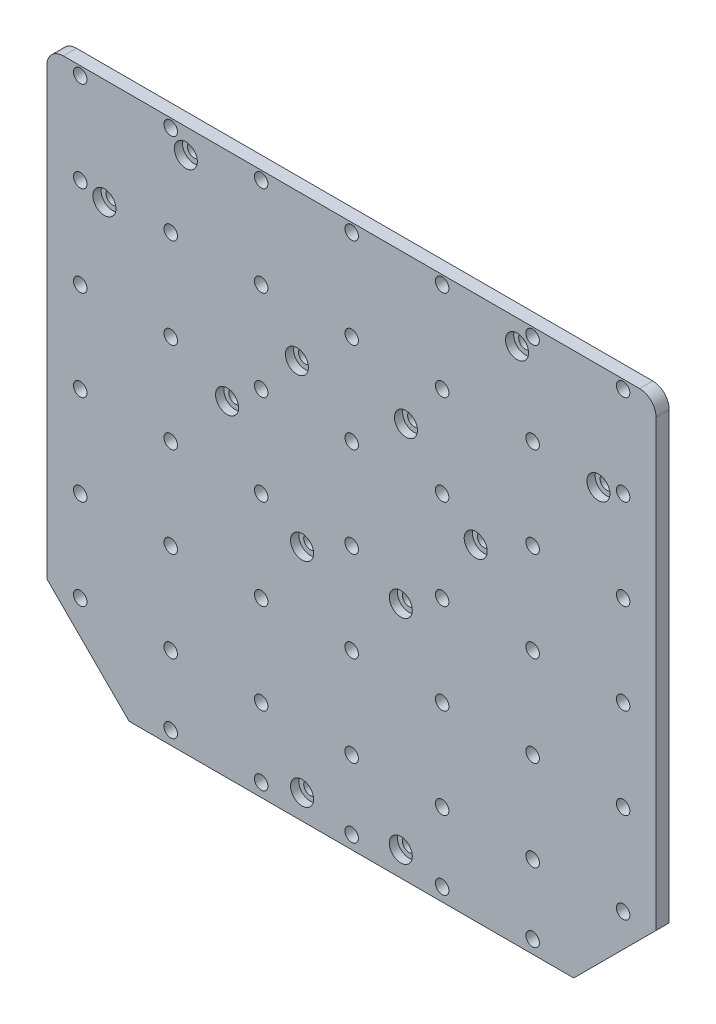
from build123d import *

# Parameters (mm, degrees)
ESQUISSE2_W             = 370.3
ESQUISSE2_H             = 330.3
BOSS_EXTRU_1_DEPTH      = 8
CONG_1_R                = 10
CHANFREIN1_SIZE         = 50
ESQUISSE4_R             = 4
ENL_V_MAT_EXTRU_1_DEPTH = 10
ESQUISSE5_R             = 7
ENL_V_MAT_EXTRU_2_DEPTH = 5
ESQUISSE6_R             = 4.1
ENL_V_MAT_EXTRU_3_DEPTH = 10


with BuildPart() as part:
    # Esquisse2 → Boss.-Extru.1 (new body)
    with BuildSketch(Plane.XY):
        with Locations((0, 191)):
            Rectangle(ESQUISSE2_W, ESQUISSE2_H)
    extrude(amount=BOSS_EXTRU_1_DEPTH)

    # Congé1
    cong_1_edges = [part.edges().sort_by_distance(p)[0] for p in [
        (-185.15, 356.15, 4),
        (185.15, 356.15, 4),
    ]]
    fillet(cong_1_edges, radius=CONG_1_R)

    # Chanfrein1
    chanfrein1_edges = [part.edges().sort_by_distance(p)[0] for p in [
        (185.15, 25.85, 4),
        (-185.15, 25.85, 4),
    ]]
    chamfer(chanfrein1_edges, length=CHANFREIN1_SIZE)

    # Esquisse4 → Enlèv. mat.-Extru.1 (cut)
    with BuildSketch(Plane.XY.offset(8)):
        with Locations((30, 170.289321881)):
            Circle(ESQUISSE4_R)
        with Locations(Location((-30, 170.289321881, 0), (0, 0, 180))):
            Circle(ESQUISSE4_R)
        with Locations((-33.142135624, 266.568542495)):
            Circle(ESQUISSE4_R)
        with Locations(Location((-75.568542495, 224.142135624, 0), (0, 0, 180))):
            Circle(ESQUISSE4_R)
        with Locations((33.142135624, 266.568542495)):
            Circle(ESQUISSE4_R)
        with Locations(Location((75.568542495, 224.142135624, 0), (0, 0, 180))):
            Circle(ESQUISSE4_R)
        with Locations((30, 40.85)):
            Circle(ESQUISSE4_R)
        with Locations(Location((-30, 40.85, 0), (0, 0, 180))):
            Circle(ESQUISSE4_R)
        with Locations((-100.652525317, 341.15)):
            Circle(ESQUISSE4_R)
        with Locations(Location((-150.15, 291.652525317, 0), (0, 0, 180))):
            Circle(ESQUISSE4_R)
        with Locations(Location((100.652525317, 341.15, 0), (0, 0, 180))):
            Circle(ESQUISSE4_R)
        with Locations((150.15, 291.652525317)):
            Circle(ESQUISSE4_R)
    extrude(amount=-ENL_V_MAT_EXTRU_1_DEPTH, mode=Mode.SUBTRACT)

    # Esquisse5 → Enlèv. mat.-Extru.2 (cut)
    with BuildSketch(Plane.XY.offset(8)):
        with Locations((30, 40.85)):
            Circle(ESQUISSE5_R)
        with Locations((-30, 40.85)):
            Circle(ESQUISSE5_R)
        with Locations((30, 170.289321881)):
            Circle(ESQUISSE5_R)
        with Locations((-30, 170.289321881)):
            Circle(ESQUISSE5_R)
        with Locations((75.568542495, 224.142135624)):
            Circle(ESQUISSE5_R)
        with Locations((33.142135624, 266.568542495)):
            Circle(ESQUISSE5_R)
        with Locations((150.15, 291.652525317)):
            Circle(ESQUISSE5_R)
        with Locations((100.652525317, 341.15)):
            Circle(ESQUISSE5_R)
        with Locations((-33.142135624, 266.568542495)):
            Circle(ESQUISSE5_R)
        with Locations((-75.568542495, 224.142135624)):
            Circle(ESQUISSE5_R)
        with Locations((-150.15, 291.652525317)):
            Circle(ESQUISSE5_R)
        with Locations((-100.652525317, 341.15)):
            Circle(ESQUISSE5_R)
    extrude(amount=-ENL_V_MAT_EXTRU_2_DEPTH, mode=Mode.SUBTRACT)

    # Esquisse6 → Enlèv. mat.-Extru.3 (cut)
    with BuildSketch(Plane.XY.offset(8)):
        with Locations((165.15, 75.85)):
            Circle(ESQUISSE6_R)
        with Locations((110.15, 75.85)):
            Circle(ESQUISSE6_R)
        with Locations((55.15, 75.85)):
            Circle(ESQUISSE6_R)
        with Locations((0.15, 75.85)):
            Circle(ESQUISSE6_R)
        with Locations((-54.85, 75.85)):
            Circle(ESQUISSE6_R)
        with Locations((-109.85, 75.85)):
            Circle(ESQUISSE6_R)
        with Locations((-164.85, 75.85)):
            Circle(ESQUISSE6_R)
        with Locations((110.15, 130.85)):
            Circle(ESQUISSE6_R)
        with Locations((55.15, 130.85)):
            Circle(ESQUISSE6_R)
        with Locations((0.15, 130.85)):
            Circle(ESQUISSE6_R)
        with Locations((-54.85, 130.85)):
            Circle(ESQUISSE6_R)
        with Locations((-109.85, 130.85)):
            Circle(ESQUISSE6_R)
        with Locations((-164.85, 130.85)):
            Circle(ESQUISSE6_R)
        with Locations((110.15, 185.85)):
            Circle(ESQUISSE6_R)
        with Locations((55.15, 185.85)):
            Circle(ESQUISSE6_R)
        with Locations((0.15, 185.85)):
            Circle(ESQUISSE6_R)
        with Locations((-54.85, 185.85)):
            Circle(ESQUISSE6_R)
        with Locations((-109.85, 185.85)):
            Circle(ESQUISSE6_R)
        with Locations((-164.85, 185.85)):
            Circle(ESQUISSE6_R)
        with Locations((110.15, 240.85)):
            Circle(ESQUISSE6_R)
        with Locations((55.15, 240.85)):
            Circle(ESQUISSE6_R)
        with Locations((0.15, 240.85)):
            Circle(ESQUISSE6_R)
        with Locations((-54.85, 240.85)):
            Circle(ESQUISSE6_R)
        with Locations((-109.85, 240.85)):
            Circle(ESQUISSE6_R)
        with Locations((-164.85, 240.85)):
            Circle(ESQUISSE6_R)
        with Locations((110.15, 295.85)):
            Circle(ESQUISSE6_R)
        with Locations((55.15, 295.85)):
            Circle(ESQUISSE6_R)
        with Locations((0.15, 295.85)):
            Circle(ESQUISSE6_R)
        with Locations((-54.85, 295.85)):
            Circle(ESQUISSE6_R)
        with Locations((-109.85, 295.85)):
            Circle(ESQUISSE6_R)
        with Locations((-164.85, 295.85)):
            Circle(ESQUISSE6_R)
        with Locations((110.15, 350.85)):
            Circle(ESQUISSE6_R)
        with Locations((55.15, 350.85)):
            Circle(ESQUISSE6_R)
        with Locations((0.15, 350.85)):
            Circle(ESQUISSE6_R)
        with Locations((-54.85, 350.85)):
            Circle(ESQUISSE6_R)
        with Locations((-109.85, 350.85)):
            Circle(ESQUISSE6_R)
        with Locations((-164.85, 350.85)):
            Circle(ESQUISSE6_R)
        with Locations((165.15, 130.85)):
            Circle(ESQUISSE6_R)
        with Locations((165.15, 185.85)):
            Circle(ESQUISSE6_R)
        with Locations((165.15, 240.85)):
            Circle(ESQUISSE6_R)
        with Locations((165.15, 295.85)):
            Circle(ESQUISSE6_R)
        with Locations((165.15, 350.85)):
            Circle(ESQUISSE6_R)
        with Locations((110.15, 33.85)):
            Circle(ESQUISSE6_R)
        with Locations((55.15, 33.85)):
            Circle(ESQUISSE6_R)
        with Locations((0.15, 33.85)):
            Circle(ESQUISSE6_R)
        with Locations((-54.85, 33.85)):
            Circle(ESQUISSE6_R)
        with Locations((-109.85, 33.85)):
            Circle(ESQUISSE6_R)
    extrude(amount=-ENL_V_MAT_EXTRU_3_DEPTH, mode=Mode.SUBTRACT)


solid = part.part
